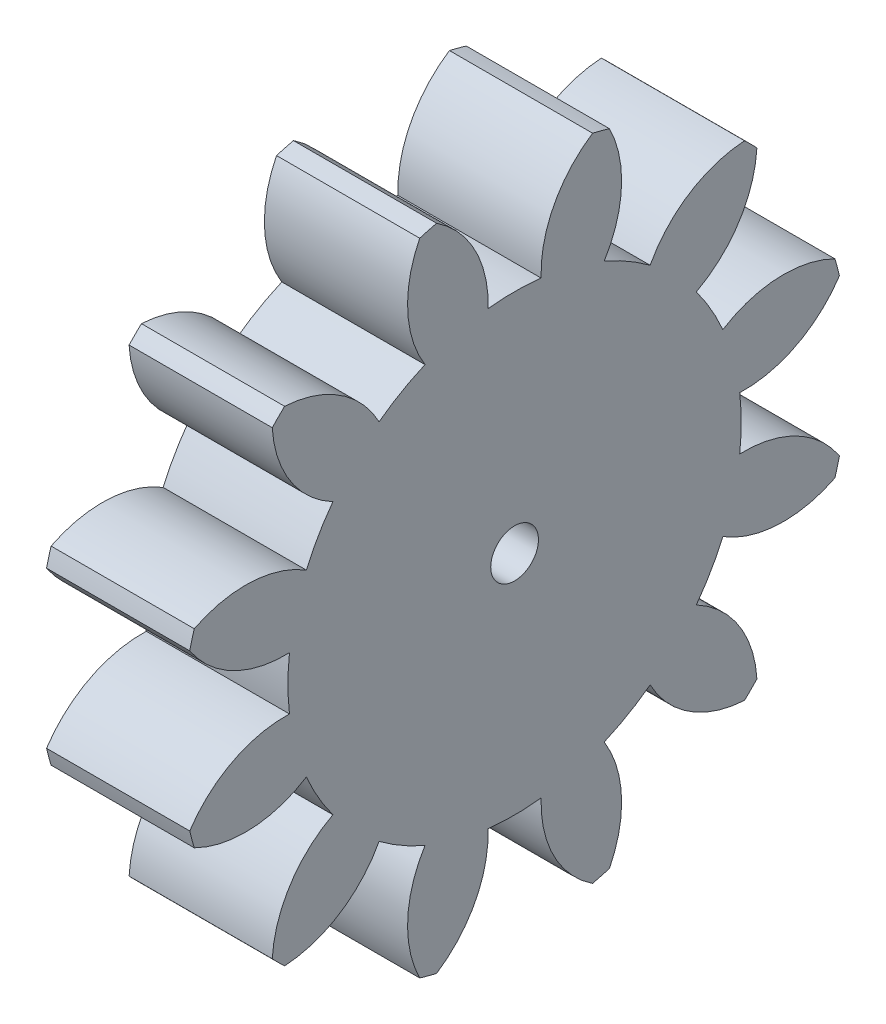
from build123d import *

# Parameters (mm, degrees)
BASPROSKE_W     = 15
BASPROSKE_H     = 35
TOOTHCUT_DEPTH  = 52.720402164
TEETHCUTS_COUNT = 12
TEETHCUTS_ANGLE = 330
BORSKE_R        = 2.5
BORE_DEPTH      = 50.0000508


with BuildPart() as part:
    # BasProSke → Base-Revolve (revolve)
    with BuildSketch(Plane(origin=(0, 0, 0), x_dir=(1, 0, 0), z_dir=(0, 1, 0)), mode=Mode.PRIVATE) as base_revolve_sk:
        with Locations((7.5, 17.5)):
            Rectangle(BASPROSKE_W, BASPROSKE_H)
    revolve(base_revolve_sk.sketch.rotate(Axis((-10, 0, 0), (1, 0, 0)), 180), axis=Axis((-10, 0, 0), (1, 0, 0)))

    # TooCutSke → ToothCut (cut, through all)
    with BuildSketch(Plane(origin=(0, 0, 0), x_dir=(0, 0, -1), z_dir=(1, 0, 0))):
        with BuildLine():
            ThreePointArc((2.779025365, 23.585843615), (0, 23.749), (-2.779025365, 23.585843615))
            ThreePointArc((-2.779025365, 23.585843615), (-4.116196739, 29.530367698), (-8.200466404, 34.051886819))
            ThreePointArc((-8.200466404, 34.051886819), (0, 35.0254), (8.200466404, 34.051886819))
            ThreePointArc((8.200466404, 34.051886819), (4.116196739, 29.530367698), (2.779025365, 23.585843615))
        make_face()
    toothcut = extrude(amount=TOOTHCUT_DEPTH, mode=Mode.SUBTRACT)

    # TeethCuts: ToothCut ×12 about axis
    teethcuts_axis = Axis((-10, 0, 0), (1, 0, 0))
    for i in range(1, TEETHCUTS_COUNT):
        add(toothcut.rotate(teethcuts_axis, i * TEETHCUTS_ANGLE / (TEETHCUTS_COUNT - 1)), mode=Mode.SUBTRACT)

    # BorSke → Bore (cut, symmetric)
    with BuildSketch(Plane(origin=(0, 0, 0), x_dir=(0, 0, -1), z_dir=(1, 0, 0))):
        with Locations(Location((0, 0, 0), (0, 0, 180))):
            Circle(BORSKE_R)
    extrude(amount=BORE_DEPTH, both=True, mode=Mode.SUBTRACT)


solid = part.part
